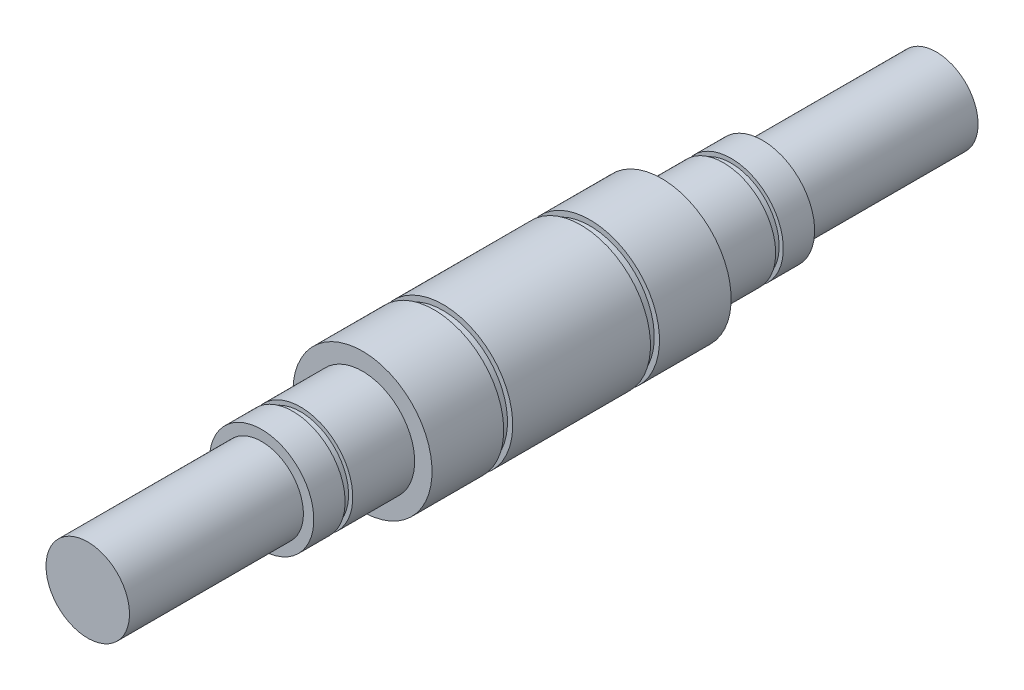
from build123d import *

# Parameters (mm, degrees)
SKETCH1_R           = 10
BOSS_EXTRUDE1_DEPTH = 61
SKETCH2_W           = 39.5
SKETCH2_H           = 2.5
SKETCH3_W           = 25
SKETCH3_H           = 1.5
SKETCH4_W           = 1.1
SKETCH4_H           = 0.6
SKETCH5_W           = 1.3
SKETCH5_H           = 0.75


with BuildPart() as part:
    # Sketch1 → Boss-Extrude1 (new, symmetric)
    with BuildSketch(Plane.XY):
        with Locations(Location((0, 0, 0), (0, 0, 180))):
            Circle(SKETCH1_R)
    extrude(amount=BOSS_EXTRUDE1_DEPTH, both=True)

    # Sketch2 → Cut-Revolve1 (revolve, cut)
    with BuildSketch(Plane(origin=(0, 0, 0), x_dir=(0, 0, -1), z_dir=(1, 0, 0)), mode=Mode.PRIVATE) as cut_revolve1_sk:
        with Locations((41.25, 8.75)):
            Rectangle(SKETCH2_W, SKETCH2_H)
    cut_revolve1 = revolve(cut_revolve1_sk.sketch.rotate(Axis((0, 0, -67.1), (0, 0, 1)), 90), axis=Axis((0, 0, -67.1), (0, 0, 1)), mode=Mode.SUBTRACT)

    # Mirror1: Cut-Revolve1 across plane
    add(cut_revolve1.mirror(Plane.XY), mode=Mode.SUBTRACT)

    # Sketch3 → Cut-Revolve2 (revolve, cut)
    with BuildSketch(Plane(origin=(0, 0, 0), x_dir=(0, 0, -1), z_dir=(1, 0, 0)), mode=Mode.PRIVATE) as cut_revolve2_sk:
        with Locations((48.5, 6.75)):
            Rectangle(SKETCH3_W, SKETCH3_H)
    cut_revolve2 = revolve(cut_revolve2_sk.sketch.rotate(Axis((0, 0, -67.1), (0, 0, 1)), 90), axis=Axis((0, 0, -67.1), (0, 0, 1)), mode=Mode.SUBTRACT)

    # Mirror2: Cut-Revolve2 across plane
    add(cut_revolve2.mirror(Plane.XY), mode=Mode.SUBTRACT)

    # Sketch4 → Cut-Revolve3 (revolve, cut)
    with BuildSketch(Plane(origin=(0, 0, 0), x_dir=(0, 0, -1), z_dir=(1, 0, 0)), mode=Mode.PRIVATE) as cut_revolve3_sk:
        with Locations((30.95, 7.2)):
            Rectangle(SKETCH4_W, SKETCH4_H)
    cut_revolve3 = revolve(cut_revolve3_sk.sketch.rotate(Axis((0, 0, -67.1), (0, 0, 1)), 90), axis=Axis((0, 0, -67.1), (0, 0, 1)), mode=Mode.SUBTRACT)

    # Mirror3: Cut-Revolve3 across plane
    add(cut_revolve3.mirror(Plane.XY), mode=Mode.SUBTRACT)

    # Sketch5 → Cut-Revolve4 (revolve, cut)
    with BuildSketch(Plane(origin=(0, 0, 0), x_dir=(0, 0, -1), z_dir=(1, 0, 0)), mode=Mode.PRIVATE) as cut_revolve4_sk:
        with Locations((10.55, 9.625)):
            Rectangle(SKETCH5_W, SKETCH5_H)
    cut_revolve4 = revolve(cut_revolve4_sk.sketch.rotate(Axis((0, 0, -67.1), (0, 0, 1)), 90), axis=Axis((0, 0, -67.1), (0, 0, 1)), mode=Mode.SUBTRACT)

    # Mirror4: Cut-Revolve4 across plane
    add(cut_revolve4.mirror(Plane.XY), mode=Mode.SUBTRACT)


solid = part.part
